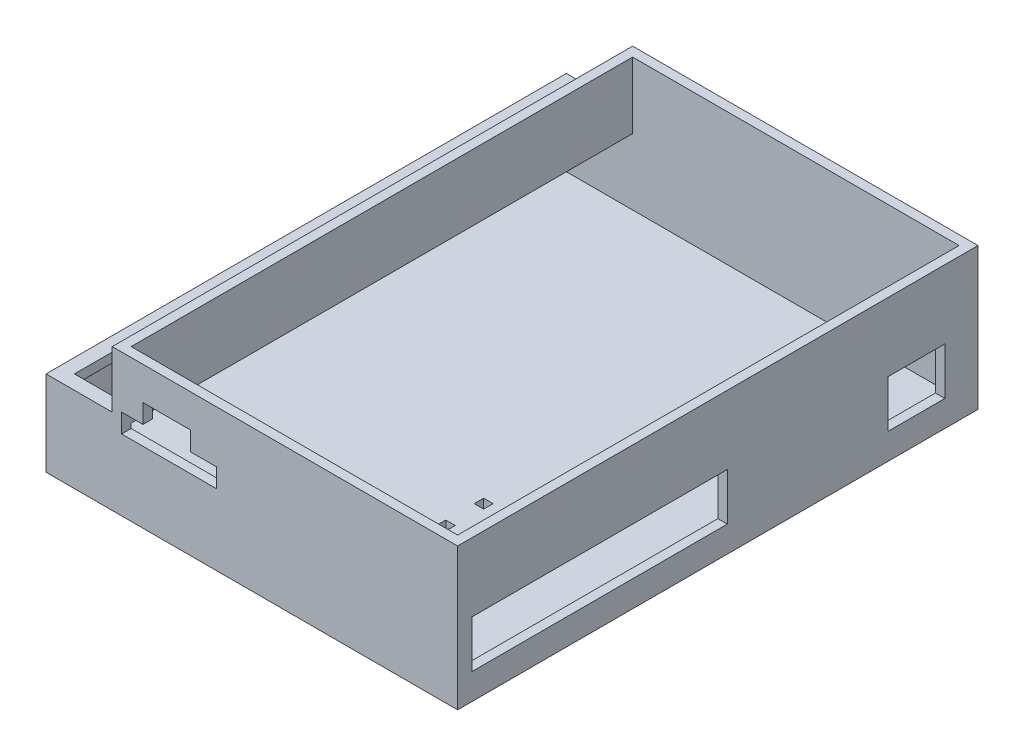
from build123d import *

# Parameters (mm, degrees)
IZIM2_W                      = 87
IZIM2_H                      = 110
Y_KSEKLIK_EKSTR_ZYON1_DEPTH  = 28
BO_ALTMA1_T                  = -2
IZIM3_W                      = 66
IZIM3_H                      = 10
KES_EKSTR_ZYON1_DEPTH        = 2
IZIM4_W                      = 14
IZIM4_H                      = 14
KES_EKSTR_ZYON3_DEPTH        = 110
IZIM5_W                      = 16
IZIM5_H                      = 110
Y_KSEKLIK_EKSTR_ZYON2_DEPTH  = 2
IZIM7_W                      = 10
IZIM7_H                      = 34
KES_EKSTR_ZYON4_DEPTH        = 1
IZIM8_W                      = 10
IZIM8_H                      = 4
IZIM8_W_2                    = 20
KES_EKSTR_ZYON5_DEPTH        = 2
IZIM9_W                      = 54
IZIM9_H                      = 10
KES_EKSTR_ZYON6_DEPTH        = 2
IZIM10_W                     = 87
IZIM10_H                     = 110
Y_KSEKLIK_EKSTR_ZYON4_DEPTH  = 2
IZIM11_W                     = 12
IZIM11_H                     = 10
KES_EKSTR_ZYON7_DEPTH        = 2
IZIM12_W                     = 2
IZIM12_H                     = 2
KES_EKSTR_ZYON8_DEPTH        = 2
IZIM14_W                     = 10
IZIM14_H                     = 34
KES_EKSTR_ZYON9_DEPTH        = 2
IZIM15_W                     = 106
IZIM15_H                     = 12
Y_KSEKLIK_EKSTR_ZYON15_DEPTH = 2


with BuildPart() as part:
    # Çizim2 → Yükseklik-Ekstrüzyon1 (new body)
    with BuildSketch(Plane(origin=(0, 0, 0), x_dir=(1, 0, 0), z_dir=(0, 1, 0))):
        with Locations((43.5, 55)):
            Rectangle(IZIM2_W, IZIM2_H)
    extrude(amount=Y_KSEKLIK_EKSTR_ZYON1_DEPTH)

    # İç Boşaltma1
    bo_altma1_openings = [part.faces().sort_by_distance(p)[0] for p in [
        (43.5, 28, -55),
        (43.5, 0, -55),
    ]]
    offset(amount=BO_ALTMA1_T, openings=bo_altma1_openings, kind=Kind.INTERSECTION)

    # Çizim3 → Kes-Ekstrüzyon1 (cut)
    with BuildSketch(Plane.ZY):
        with Locations((-73, 8.5)):
            Rectangle(IZIM3_W, IZIM3_H)
    extrude(amount=-KES_EKSTR_ZYON1_DEPTH, mode=Mode.SUBTRACT)

    # Çizim4 → Kes-Ekstrüzyon3 (cut)
    with BuildSketch(Plane(origin=(0, 0, -110), x_dir=(-1, 0, 0), z_dir=(0, 0, -1))):
        with Locations((-7, 21)):
            Rectangle(IZIM4_W, IZIM4_H)
    extrude(amount=-KES_EKSTR_ZYON3_DEPTH, mode=Mode.SUBTRACT)

    # Çizim5 → Yükseklik-Ekstrüzyon2 (add)
    with BuildSketch(Plane(origin=(0, 14, 0), x_dir=(1, 0, 0), z_dir=(0, 1, 0))):
        with Locations((8, 55)):
            Rectangle(IZIM5_W, IZIM5_H)
    extrude(amount=Y_KSEKLIK_EKSTR_ZYON2_DEPTH)

    # Çizim7 → Kes-Ekstrüzyon4 (cut)
    with BuildSketch(Plane(origin=(0, 16, 0), x_dir=(1, 0, 0), z_dir=(0, 1, 0))):
        with Locations((8, 20)):
            Rectangle(IZIM7_W, IZIM7_H)
    extrude(amount=-KES_EKSTR_ZYON4_DEPTH, mode=Mode.SUBTRACT)

    # Çizim8 → Kes-Ekstrüzyon5 (cut)
    with BuildSketch(Plane.XY):
        with Locations((25.500000105, 19)):
            Rectangle(IZIM8_W, IZIM8_H)
        with Locations((26, 15)):
            Rectangle(IZIM8_W_2, IZIM8_H)
    extrude(amount=-KES_EKSTR_ZYON5_DEPTH, mode=Mode.SUBTRACT)

    # Çizim9 → Kes-Ekstrüzyon6 (cut)
    with BuildSketch(Plane(origin=(87, 0, 0), x_dir=(0, 0, -1), z_dir=(1, 0, 0))):
        with Locations((30, 8.5)):
            Rectangle(IZIM9_W, IZIM9_H)
    extrude(amount=-KES_EKSTR_ZYON6_DEPTH, mode=Mode.SUBTRACT)

    # Çizim10 → Yükseklik-Ekstrüzyon4 (add)
    with BuildSketch(Plane.XZ):
        with Locations((43.5, -55)):
            Rectangle(IZIM10_W, IZIM10_H)
    extrude(amount=Y_KSEKLIK_EKSTR_ZYON4_DEPTH)

    # Çizim11 → Kes-Ekstrüzyon7 (cut)
    with BuildSketch(Plane(origin=(87, 0, 0), x_dir=(0, 0, -1), z_dir=(1, 0, 0))):
        with Locations((97, 8.5)):
            Rectangle(IZIM11_W, IZIM11_H)
    extrude(amount=-KES_EKSTR_ZYON7_DEPTH, mode=Mode.SUBTRACT)

    # Çizim12 → Kes-Ekstrüzyon8 (cut)
    with BuildSketch(Plane.XZ.offset(2)):
        with Locations((54, -6.5)):
            Rectangle(IZIM12_W, IZIM12_H)
        with Locations((54, -38.5)):
            Rectangle(IZIM12_W, IZIM12_H)
        with Locations((54, -22.5)):
            Rectangle(IZIM12_W, IZIM12_H)
        with Locations((54, -14.5)):
            Rectangle(IZIM12_W, IZIM12_H)
        with Locations((54, -30.5)):
            Rectangle(IZIM12_W, IZIM12_H)
    extrude(amount=-KES_EKSTR_ZYON8_DEPTH, mode=Mode.SUBTRACT)

    # Çizim14 → Kes-Ekstrüzyon9 (cut)
    with BuildSketch(Plane(origin=(0, 15, 0), x_dir=(1, 0, 0), z_dir=(0, 1, 0))):
        with Locations((8, 20)):
            Rectangle(IZIM14_W, IZIM14_H)
    extrude(amount=-KES_EKSTR_ZYON9_DEPTH, mode=Mode.SUBTRACT)

    # Çizim15 → Yükseklik-Ekstrüzyon15 (add)
    with BuildSketch(Plane.ZY.offset(-14)):
        with Locations((-55, 22)):
            Rectangle(IZIM15_W, IZIM15_H)
    extrude(amount=-Y_KSEKLIK_EKSTR_ZYON15_DEPTH)


solid = part.part
